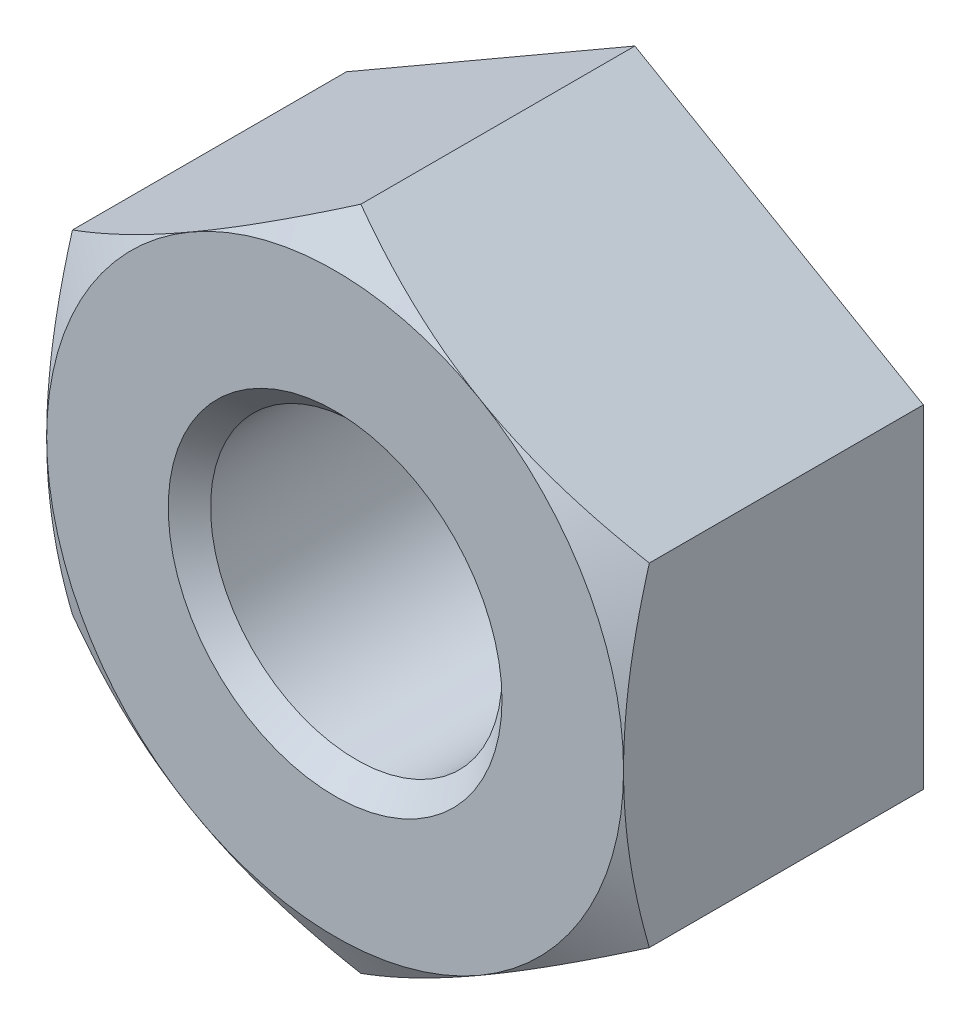
from build123d import *

# Parameters (mm, degrees)
BOSS_EXTRUDE1_DEPTH          = 21.6
SKETCH3_OUTSIDE_W            = 131.808
SKETCH3_OUTSIDE_H            = 138.238
SKETCH3_OUTSIDE_R            = 20.784609691
CUT_EXTRUDE1_DEPTH           = 21.6
CUT_EXTRUDE1_DRAFT           = -60
M24_TAPPED_HOLE1_D           = 21
M24_TAPPED_HOLE1_CSINK_D     = 24.05
M24_TAPPED_HOLE1_CSINK_ANGLE = 90


with BuildPart() as part:
    # Sketch1 → Boss-Extrude1 (new body)
    with BuildSketch(Plane.XY):
        Polygon((20.784609691, -12), (20.784609691, 12), (0, 24), (-20.784609691, 12), (-20.784609691, -12), (0, -24), align=None)
    extrude(amount=BOSS_EXTRUDE1_DEPTH)


with BuildPart() as cut_extrude1_tool:
    # Sketch3 outside → Cut-Extrude1 (with draft: the straight prism first)
    with BuildSketch(Plane.XY.offset(21.6)):
        Rectangle(SKETCH3_OUTSIDE_W, SKETCH3_OUTSIDE_H)
        Circle(SKETCH3_OUTSIDE_R, mode=Mode.SUBTRACT)
    extrude(amount=-CUT_EXTRUDE1_DEPTH)
    # Cut-Extrude1: the draft: its side faces are tilted about the plane it starts from
    cut_extrude1_sides = [cut_extrude1_tool.faces().sort_by_distance(p)[0] for p in [
        (0, -69.119, 10.8),
        (65.904, 0, 10.8),
        (0, 69.119, 10.8),
        (-65.904, 0, 10.8),
        (-20.784609691, 0, 10.8),
    ]]
    draft(cut_extrude1_sides, Plane.XY.offset(21.6), CUT_EXTRUDE1_DRAFT)


with BuildPart() as part_1:
    add(part.part)

    # Cut-Extrude1: cut by cut_extrude1_tool
    add(cut_extrude1_tool.part, mode=Mode.SUBTRACT)

    # M24 Tapped Hole1 (through all)
    with Locations(Plane.XY.offset(21.6)):
        with Locations((0, 0)):
            CounterSinkHole(M24_TAPPED_HOLE1_D / 2, M24_TAPPED_HOLE1_CSINK_D / 2, counter_sink_angle=M24_TAPPED_HOLE1_CSINK_ANGLE)


solid = part_1.part
